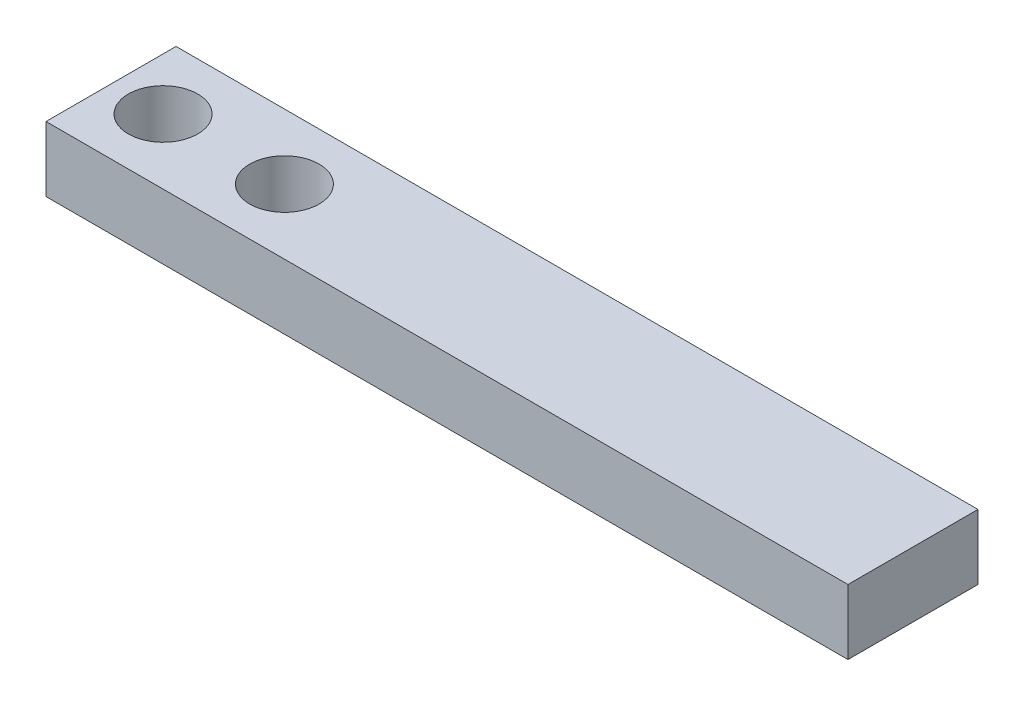
from build123d import *

# Parameters (mm, degrees)
SKETCH1_W                    = 18.5
SKETCH1_H                    = 3
BOSS_EXTRUDE1_DEPTH          = 1.5
F_97_0_0059_DIAMETER_HOLE1_D = 1.600000102


with BuildPart() as part:
    # Sketch1 → Boss-Extrude1 (new body)
    with BuildSketch(Plane(origin=(0, 0, 0), x_dir=(1, 0, 0), z_dir=(0, 1, 0))):
        with Locations((9.25, 1.5)):
            Rectangle(SKETCH1_W, SKETCH1_H)
    extrude(amount=BOSS_EXTRUDE1_DEPTH)

    # #97 (0.0059) Diameter Hole1 (through all)
    with Locations(Plane(origin=(0, 1.5, 0), x_dir=(1, 0, 0), z_dir=(0, 1, 0))):
        with Locations((1.2, 1.5), (4, 1.5)):
            Hole(F_97_0_0059_DIAMETER_HOLE1_D / 2)


solid = part.part
